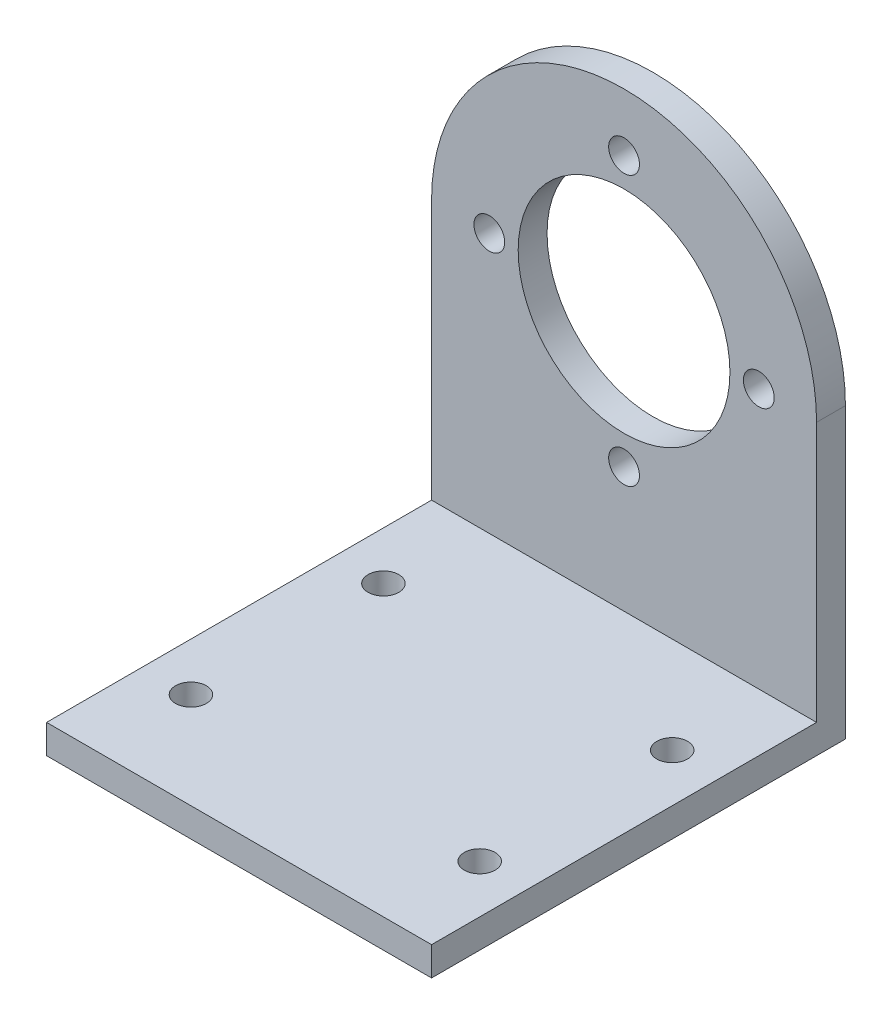
from build123d import *

# Parameters (mm, degrees)
SKETCH_1_W               = 40
SKETCH_1_H               = 27
EXTRUDE_1_DEPTH          = 3
EXTRUDE_2_DEPTH          = 3
SKETCH_3_W               = 40
SKETCH_3_H               = 43
EXTRUDE_3_DEPTH          = 3
SKETCH_5_R               = 11
CUT_EXTRUDE_1_DEPTH      = 59.062466362
SKETCH_6_R               = 1.6
CUT_EXTRUDE_2_DEPTH      = 59.062466362
PATTERN_CIRCULAR_1_COUNT = 4
SKETCH_7_R               = 1.6
CUT_EXTRUDE_3_DEPTH      = 69.912988616
PATTERN_LINEAR_1_COUNT   = 2
PATTERN_LINEAR_1_PITCH   = 20
MIRROR_1_COPY_1_SKETCH_R = 1.6
MIRROR_1_COPY_1_DEPTH    = 69.912988616


with BuildPart() as part:
    # 草图1 → 凸台-拉伸1 (new body)
    with BuildSketch(Plane.XY):
        Rectangle(SKETCH_1_W, SKETCH_1_H)
    extrude(amount=EXTRUDE_1_DEPTH)

    # 草图2 → 凸台-拉伸2 (add)
    with BuildSketch(Plane(origin=(0, 0, 0), x_dir=(-1, 0, 0), z_dir=(0, 0, -1))):
        with BuildLine():
            Line((-20, 13.5), (20, 13.5))
            ThreePointArc((20, 13.5), (0, 33.5), (-20, 13.5))
        make_face()
    extrude(amount=-EXTRUDE_2_DEPTH)

    # 草图3 → 凸台-拉伸3 (add)
    with BuildSketch(Plane.XZ.offset(13.5)):
        with Locations((0, 21.5)):
            Rectangle(SKETCH_3_W, SKETCH_3_H)
    extrude(amount=EXTRUDE_3_DEPTH)

    # 草图5 → 切除-拉伸1 (cut, through all)
    with BuildSketch(Plane(origin=(0, 0, 0), x_dir=(-1, 0, 0), z_dir=(0, 0, -1))):
        with Locations((0, 13.5)):
            Circle(SKETCH_5_R)
    extrude(amount=-CUT_EXTRUDE_1_DEPTH, mode=Mode.SUBTRACT)

    # 草图6 → 切除-拉伸2 (cut, through all)
    with BuildSketch(Plane(origin=(0, 0, 0), x_dir=(-1, 0, 0), z_dir=(0, 0, -1))):
        with Locations((0, 27.5)):
            Circle(SKETCH_6_R)
    cut_extrude_2 = extrude(amount=-CUT_EXTRUDE_2_DEPTH, mode=Mode.SUBTRACT)

    # 阵列(圆周)1: 切除-拉伸2 ×4 about axis
    pattern_circular_1_axis = Axis((0, 13.5, 0), (0, 0, 1))
    for i in range(1, PATTERN_CIRCULAR_1_COUNT):
        add(cut_extrude_2.rotate(pattern_circular_1_axis, i * 360 / PATTERN_CIRCULAR_1_COUNT), mode=Mode.SUBTRACT)

    # 草图7 → 切除-拉伸3 (cut, through all)
    with BuildSketch(Plane.XZ.offset(16.5)):
        with Locations((15, 33)):
            Circle(SKETCH_7_R)
    cut_extrude_3 = extrude(amount=-CUT_EXTRUDE_3_DEPTH, mode=Mode.SUBTRACT)

    # 阵列(线性)1: 切除-拉伸3 ×2
    with Locations(*[(0, 0, -i * PATTERN_LINEAR_1_PITCH) for i in range(1, PATTERN_LINEAR_1_COUNT)]):
        add(cut_extrude_3, mode=Mode.SUBTRACT)

    # 镜向1: 切除-拉伸3 across plane
    add(cut_extrude_3.mirror(Plane(origin=(0, 0, 0), x_dir=(0, 0, 1), z_dir=(1, 0, 0))), mode=Mode.SUBTRACT)

    # 镜向1 copy 1 sketch → 镜向1 copy 1 (cut, through all)
    with BuildSketch(Plane(origin=(0, -16.5, -20), x_dir=(-1, 0, 0), z_dir=(0, -1, 0))):
        with Locations((15, -33)):
            Circle(MIRROR_1_COPY_1_SKETCH_R)
    extrude(amount=-MIRROR_1_COPY_1_DEPTH, mode=Mode.SUBTRACT)


solid = part.part
